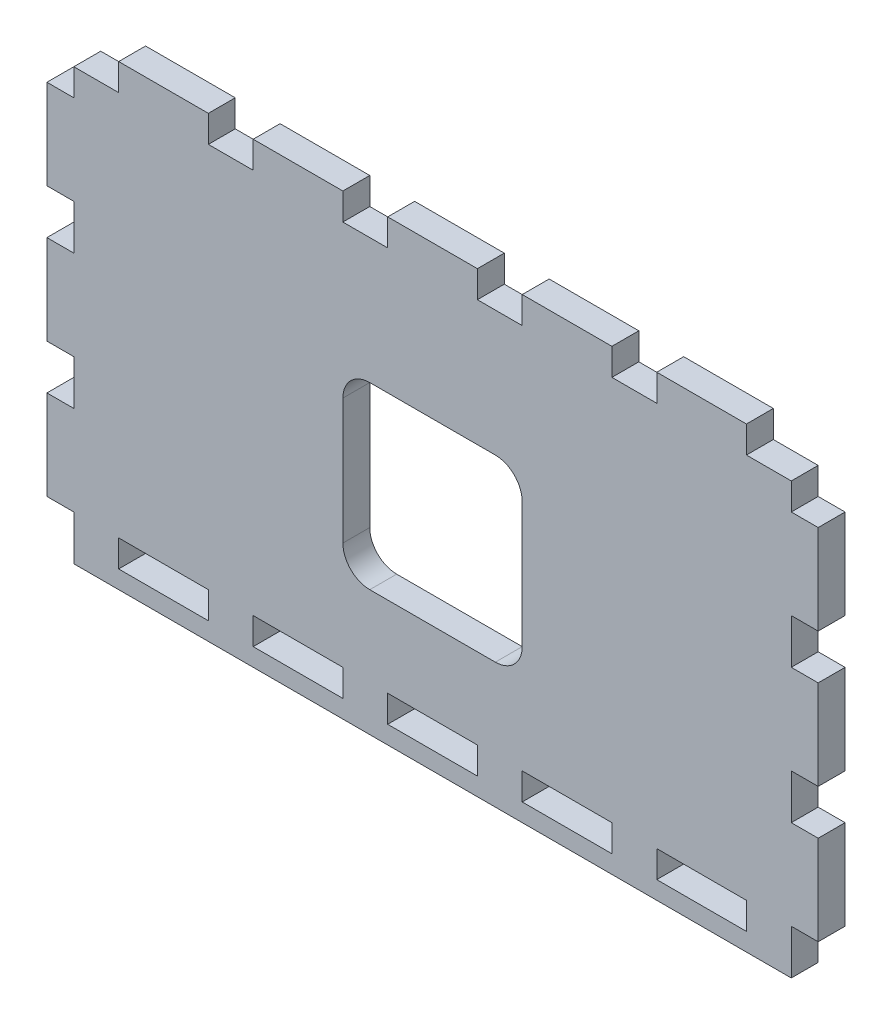
from build123d import *

# Parameters (mm, degrees)
SKETCH_1_W          = 10
SKETCH_1_H          = 3
EXTRUDE_1_DEPTH     = 3
SKETCH_2_W          = 20
SKETCH_2_H          = 20
CUT_EXTRUDE_1_DEPTH = 10
FILLET_1_R          = 3


with BuildPart() as part:
    # 草图1 → 凸台-拉伸1 (new body)
    with BuildSketch(Plane.XY):
        Polygon((-40, 24), (-35, 24), (-35, 27), (-25, 27), (-25, 24), (-20, 24), (-20, 27), (-10, 27), (-10, 24), (-5, 24), (-5, 27), (5, 27), (5, 24), (10, 24), (10, 27), (20, 27), (20, 24), (25, 24), (25, 27), (35, 27), (35, 24), (40, 24), (40, 21), (43, 21), (43, 11), (40, 11), (40, 6), (43, 6), (43, -4), (40, -4), (40, -9), (43, -9), (43, -19), (40, -19), (40, -24), (-40, -24), (-40, -19), (-43, -19), (-43, -9), (-40, -9), (-40, -4), (-43, -4), (-43, 6), (-40, 6), (-40, 11), (-43, 11), (-43, 21), (-40, 21), align=None)
        with Locations((-15, -20.5)):
            Rectangle(SKETCH_1_W, SKETCH_1_H, mode=Mode.SUBTRACT)
        with Locations((-30, -20.5)):
            Rectangle(SKETCH_1_W, SKETCH_1_H, mode=Mode.SUBTRACT)
        with Locations((0, -20.5)):
            Rectangle(SKETCH_1_W, SKETCH_1_H, mode=Mode.SUBTRACT)
        with Locations((15, -20.5)):
            Rectangle(SKETCH_1_W, SKETCH_1_H, mode=Mode.SUBTRACT)
        with Locations((30, -20.5)):
            Rectangle(SKETCH_1_W, SKETCH_1_H, mode=Mode.SUBTRACT)
    extrude(amount=EXTRUDE_1_DEPTH)

    # 草图2 → 切除-拉伸1 (cut)
    with BuildSketch(Plane.XY.offset(3)):
        Rectangle(SKETCH_2_W, SKETCH_2_H)
    extrude(amount=-CUT_EXTRUDE_1_DEPTH, mode=Mode.SUBTRACT)

    # 圆角1
    fillet_1_edges = [part.edges().sort_by_distance(p)[0] for p in [
        (10, 10, 1.5),
        (10, -10, 1.5),
        (-10, -10, 1.5),
        (-10, 10, 1.5),
    ]]
    fillet(fillet_1_edges, radius=FILLET_1_R)


solid = part.part
